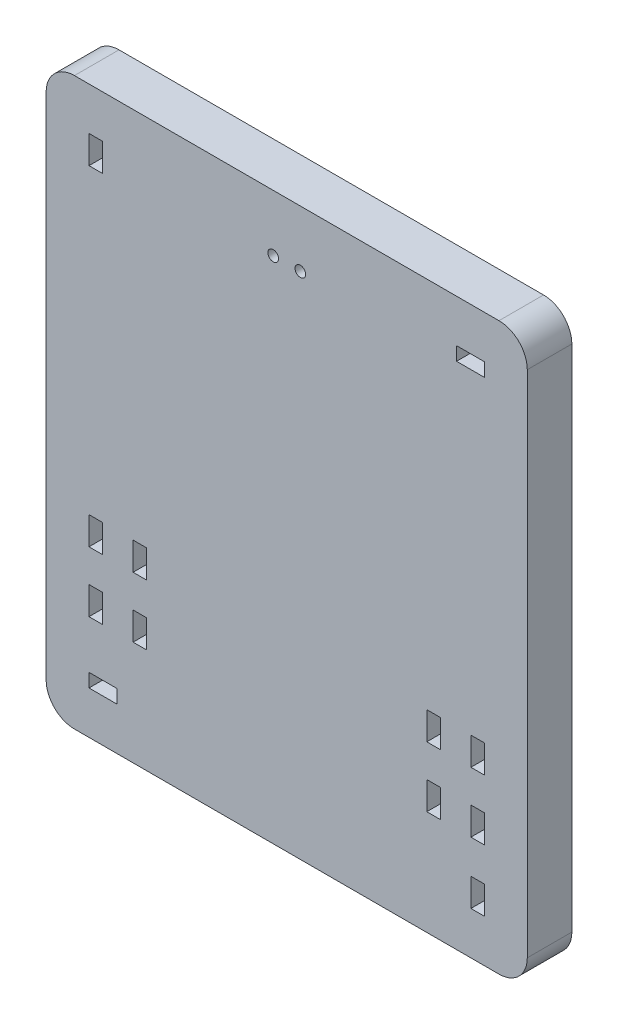
from build123d import *

# Parameters (mm, degrees)
SKETCH1_R           = 1.1938
SKETCH1_W           = 6.2611
SKETCH1_H           = 3.04
SKETCH1_W_2         = 3.04
SKETCH1_H_2         = 6.2611
SKETCH1_H_3         = 6.2541
BOSS_EXTRUDE1_DEPTH = 10


with BuildPart() as part:
    # Sketch1 → Boss-Extrude1 (new body)
    with BuildSketch(Plane.XY):
        with BuildLine():
            Line((-0.021357312, 120.65), (-0.021357312, 6.35000179))
            ThreePointArc((-0.021357312, 6.35000179), (1.838514627, 1.85987373), (6.328642688, 1.79e-06))
            Line((6.328642688, 1.79e-06), (101.6, 1.79e-06))
            ThreePointArc((101.6, 1.79e-06), (106.090128061, 1.85987373), (107.95, 6.35000179))
            Line((107.95, 6.35000179), (107.95, 120.65))
            ThreePointArc((107.95, 120.65), (106.090128061, 125.140128061), (101.6, 127))
            Line((101.6, 127), (6.328642688, 127))
            ThreePointArc((6.328642688, 127), (1.838514627, 125.140128061), (-0.021357312, 120.65))
        make_face()
        with Locations((50.927, 114.3)):
            Circle(SKETCH1_R, mode=Mode.SUBTRACT)
        with Locations((57.023, 114.3)):
            Circle(SKETCH1_R, mode=Mode.SUBTRACT)
        with Locations((12.723092688, 11.1339)):
            Rectangle(SKETCH1_W, SKETCH1_H, mode=Mode.SUBTRACT)
        with Locations((95.20555, 115.86610179)):
            Rectangle(SKETCH1_W, SKETCH1_H, mode=Mode.SUBTRACT)
        with Locations((11.112542688, 114.25555179)):
            Rectangle(SKETCH1_W_2, SKETCH1_H_2, mode=Mode.SUBTRACT)
        with Locations((11.112542688, 26.59548464)):
            Rectangle(SKETCH1_W_2, SKETCH1_H_3, mode=Mode.SUBTRACT)
        with Locations((96.8161, 26.59548464)):
            Rectangle(SKETCH1_W_2, SKETCH1_H_3, mode=Mode.SUBTRACT)
        with Locations((11.112542688, 40.17738464)):
            Rectangle(SKETCH1_W_2, SKETCH1_H_3, mode=Mode.SUBTRACT)
        with Locations((96.8161, 12.74445)):
            Rectangle(SKETCH1_W_2, SKETCH1_H_2, mode=Mode.SUBTRACT)
        with Locations((96.8161, 40.17738464)):
            Rectangle(SKETCH1_W_2, SKETCH1_H_3, mode=Mode.SUBTRACT)
        with Locations((21.010542688, 26.59548464)):
            Rectangle(SKETCH1_W_2, SKETCH1_H_3, mode=Mode.SUBTRACT)
        with Locations((21.010542688, 40.17738464)):
            Rectangle(SKETCH1_W_2, SKETCH1_H_3, mode=Mode.SUBTRACT)
        with Locations((86.9181, 26.59548464)):
            Rectangle(SKETCH1_W_2, SKETCH1_H_3, mode=Mode.SUBTRACT)
        with Locations((86.9181, 40.17738464)):
            Rectangle(SKETCH1_W_2, SKETCH1_H_3, mode=Mode.SUBTRACT)
    extrude(amount=BOSS_EXTRUDE1_DEPTH)


solid = part.part
